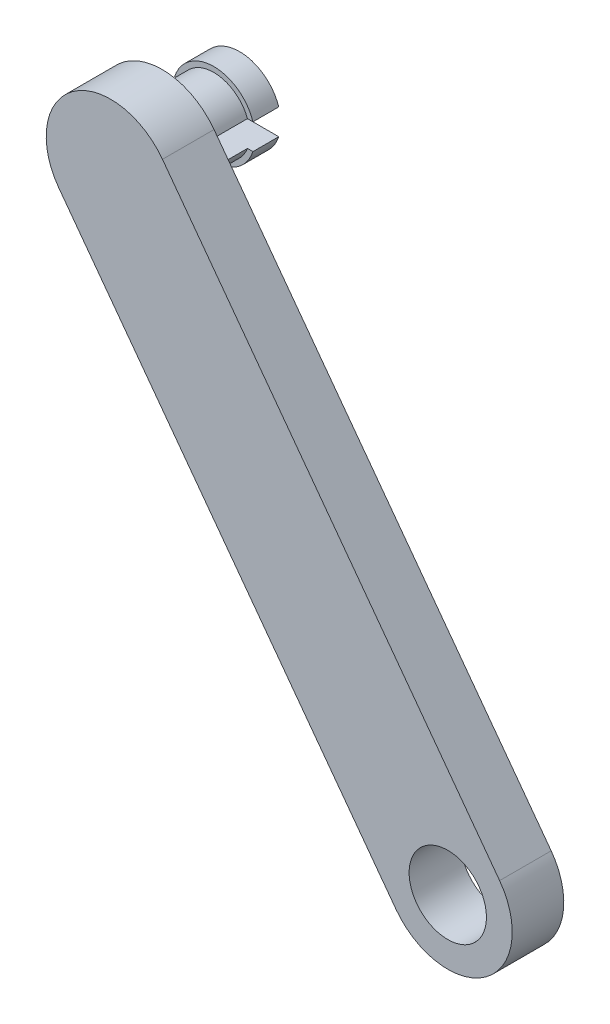
from build123d import *

# Parameters (mm, degrees)
BOSS_EXTRU_1_DEPTH      = 2
ESQUISSE3_R             = 1.5
ENL_V_MAT_EXTRU_1_DEPTH = 2
BOSS_EXTRU_2_START      = -2
ESQUISSE4_R             = 1.4
BOSS_EXTRU_2_DEPTH      = 2
ESQUISSE5_R             = 1.6
BOSS_EXTRU_3_DEPTH      = 1
ESQUISSE6_W             = 4
ESQUISSE6_H             = 1
ENL_V_MAT_EXTRU_2_DEPTH = 3


with BuildPart() as part:
    # Esquisse2 → Boss.-Extru.1 (new body)
    with BuildSketch(Plane.XY):
        with BuildLine():
            Line((-2.010396268, -6.486037297), (-15.087524479, 11.205449858))
            ThreePointArc((-15.087524479, 11.205449858), (-14.563165508, 14.701883422), (-11.066731944, 14.177524451))
            Line((-11.066731944, 14.177524451), (2.010396268, -3.513962703))
            ThreePointArc((2.010396268, -3.513962703), (1.486037297, -7.010396268), (-2.010396268, -6.486037297))
        make_face()
    extrude(amount=BOSS_EXTRU_1_DEPTH)

    # Esquisse3 → Enlèv. mat.-Extru.1 (cut)
    with BuildSketch(Plane.XY.offset(2)):
        with Locations((0, -5)):
            Circle(ESQUISSE3_R)
    extrude(amount=-ENL_V_MAT_EXTRU_1_DEPTH, mode=Mode.SUBTRACT)

    # Esquisse4 → Boss.-Extru.2 (add)
    with BuildSketch(Plane.XY.offset(2).offset(BOSS_EXTRU_2_START)):
        with Locations((-13.077128211, 12.691487155)):
            Circle(ESQUISSE4_R)
    extrude(amount=-BOSS_EXTRU_2_DEPTH)

    # Esquisse5 → Boss.-Extru.3 (add)
    with BuildSketch(Plane(origin=(0, 0, -2), x_dir=(-1, 0, 0), z_dir=(0, 0, -1))):
        with Locations((13.077128211, 12.691487155)):
            Circle(ESQUISSE5_R)
    extrude(amount=BOSS_EXTRU_3_DEPTH)

    # Esquisse6 → Enlèv. mat.-Extru.2 (cut)
    with BuildSketch(Plane(origin=(0, 0, -3), x_dir=(-1, 0, 0), z_dir=(0, 0, -1))):
        with Locations((13.077128211, 12.691487155)):
            Rectangle(ESQUISSE6_W, ESQUISSE6_H)
    extrude(amount=-ENL_V_MAT_EXTRU_2_DEPTH, mode=Mode.SUBTRACT)


solid = part.part
